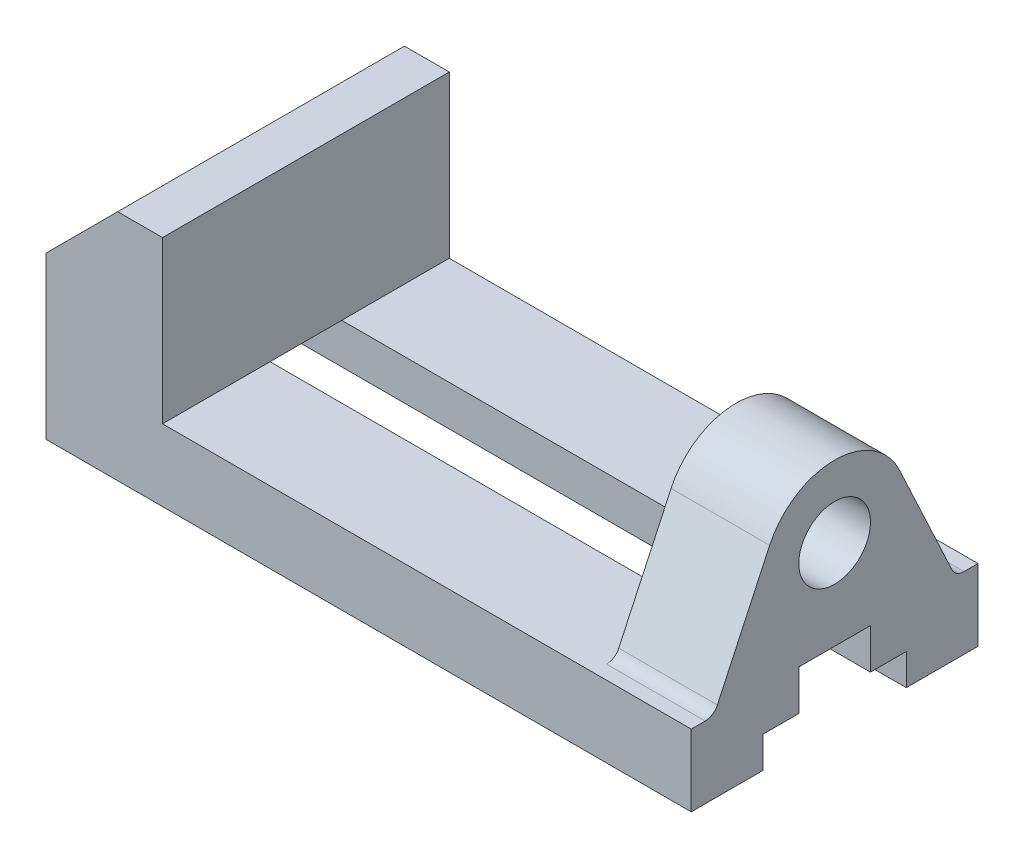
from build123d import *

# Parameters (mm, degrees)
BOSS_EXTRUDE1_DEPTH  = 32
SKETCH3_R            = 8
BOSS_EXTRUDE2_DEPTH  = 22
FILLET1_R            = 3
CUT_EXTRUDE1_DEPTH   = 157.409718368
LPATTERN1_COUNT      = 2
LPATTERN1_PITCH      = 70
LPATTERN1_COUNT_DIR2 = 2
LPATTERN1_PITCH_DIR2 = 44


with BuildPart() as part:
    # Sketch1 → Boss-Extrude1 (new, symmetric)
    with BuildSketch(Plane.XY):
        Polygon((0, 0), (0, 36), (16, 52), (26, 52), (26, 16), (144, 16), (144, 0), align=None)
    extrude(amount=BOSS_EXTRUDE1_DEPTH, both=True)

    # Sketch3 → Boss-Extrude2 (add)
    with BuildSketch(Plane(origin=(144, 0, 0), x_dir=(0, 0, -1), z_dir=(1, 0, 0))):
        with BuildLine():
            Line((-26.980199866, 16), (-14.500924593, 42.761892188))
            ThreePointArc((-14.500924593, 42.761892188), (0, 52), (14.500924593, 42.761892188))
            Line((14.500924593, 42.761892188), (26.980199866, 16))
            Line((26.980199866, 16), (-26.980199866, 16))
        make_face()
        with Locations((0, 36)):
            Circle(SKETCH3_R, mode=Mode.SUBTRACT)
    extrude(amount=-BOSS_EXTRUDE2_DEPTH)

    # Fillet1
    fillet1_edges = [part.edges().sort_by_distance(p)[0] for p in [
        (133, 16, -26.980199866),
        (133, 16, 26.980199866),
    ]]
    fillet(fillet1_edges, radius=FILLET1_R)

    # Sketch4 → Cut-Extrude1 (cut, through all)
    with BuildSketch(Plane(origin=(144, 0, 0), x_dir=(0, 0, -1), z_dir=(1, 0, 0))):
        Polygon((-16, -4.423588756), (-16, 7), (-8, 7), (-8, 16), (8, 16), (8, 7), (16, 7), (16, -4.423588756), align=None)
    extrude(amount=-CUT_EXTRUDE1_DEPTH, mode=Mode.SUBTRACT)

    # Sketch6 → Ø1.0mm Dowel Hole1 (revolve, cut)
    with BuildSketch(Plane(origin=(38, 0, -22), x_dir=(0, 0, -1), z_dir=(1, 0, 0))):
        Polygon((0, 0), (0, 11.732050808), (3, 10), (3, 0), align=None)
    f_1_0mm_dowel_hole1 = revolve(axis=Axis((38, -6.35, -22), (0, 1, 0)), mode=Mode.SUBTRACT)

    # LPattern1: 1.0mm Dowel Hole1 2 × 2
    with Locations(*[(i * LPATTERN1_PITCH, 0, j * LPATTERN1_PITCH_DIR2) for i in range(LPATTERN1_COUNT) for j in range(LPATTERN1_COUNT_DIR2) if (i, j) != (0, 0)]):
        add(f_1_0mm_dowel_hole1, mode=Mode.SUBTRACT)


solid = part.part
